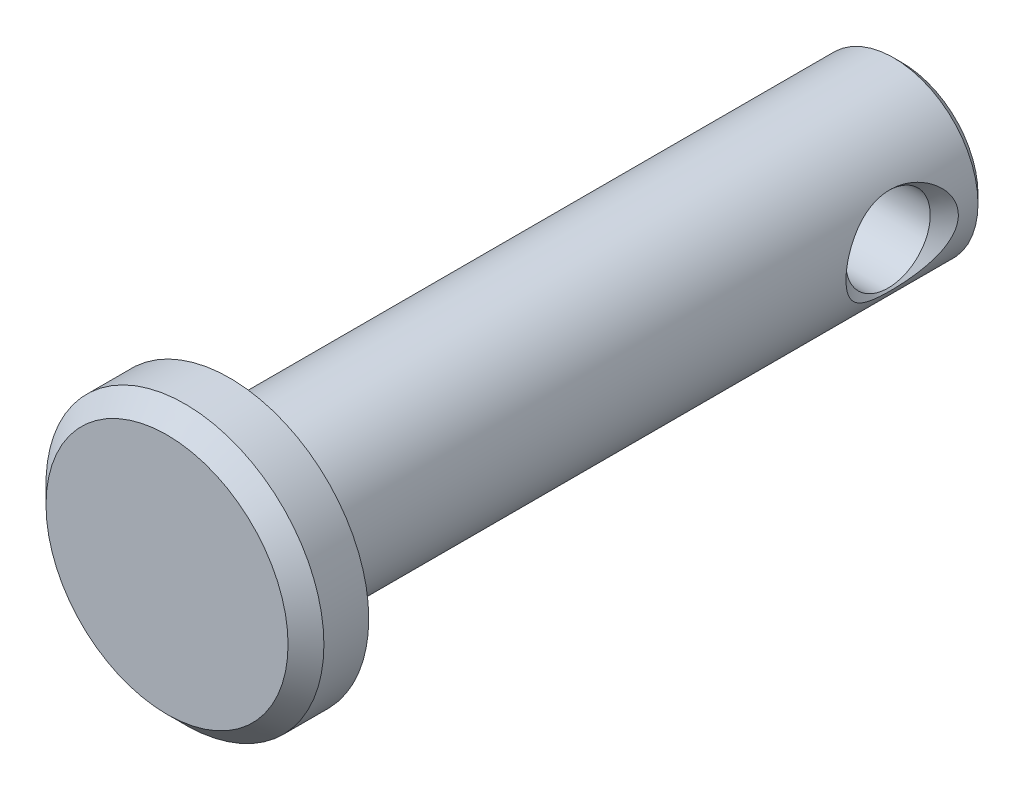
from build123d import *

# Parameters (mm, degrees)
CUT_EXTRUDE1_DEPTH      = 12.808951435
CUT_EXTRUDE1_DEPTH_BACK = 12.808951435
SKETCH3_R               = 1.1938


with BuildPart() as part:
    # Sketch2 → Revolve1 (revolve)
    with BuildSketch(Plane(origin=(0, 0, 0), x_dir=(0, 0, -1), z_dir=(1, 0, 0)), mode=Mode.PRIVATE) as revolve1_sk:
        with BuildLine():
            Line((10.17524, 2.3876), (-8.51662, 2.3876))
            ThreePointArc((-8.51662, 2.3876), (-8.601034408, 2.422565592), (-8.636, 2.50698))
            Line((-8.636, 2.50698), (-8.636, 3.937))
            Line((-8.636, 3.937), (-9.906, 3.937))
            Line((-9.906, 3.937), (-10.414, 3.429))
            Line((-10.414, 3.429), (-10.414, 0))
            Line((-10.414, 0), (10.414, 0))
            Line((10.414, 0), (10.414, 2.14884))
            Line((10.414, 2.14884), (10.17524, 2.3876))
        make_face()
    revolve(revolve1_sk.sketch.rotate(Axis((0, 0, 10.414), (0, 0, -1)), 90), axis=Axis((0, 0, 10.414), (0, 0, -1)))

    # Sketch3 → Cut-Extrude1 (cut, two sides: drawn at the far end of the back side and taken through both)
    with BuildSketch(Plane(origin=(0, 0, 0), x_dir=(0, 0, -1), z_dir=(1, 0, 0)).offset(-CUT_EXTRUDE1_DEPTH_BACK)):
        with Locations((8.0264, 0)):
            Circle(SKETCH3_R)
    extrude(amount=CUT_EXTRUDE1_DEPTH + CUT_EXTRUDE1_DEPTH_BACK, mode=Mode.SUBTRACT)

    # Sketch4 → Cut-Revolve1 (revolve, cut)
    with BuildSketch(Plane(origin=(0, 0, 0), x_dir=(1, 0, 0), z_dir=(0, 1, 0)), mode=Mode.PRIVATE) as cut_revolve1_sk:
        Polygon((2.3876, 6.434666667), (0.795866667, 8.0264), (2.3876, 8.0264), align=None)
        Polygon((-2.3876, 8.0264), (-2.3876, 6.434666667), (-0.795866667, 8.0264), align=None)
    revolve(cut_revolve1_sk.sketch.rotate(Axis((2.3876, 0, -8.0264), (-1, 0, 0)), 180), axis=Axis((2.3876, 0, -8.0264), (-1, 0, 0)), mode=Mode.SUBTRACT)


solid = part.part
